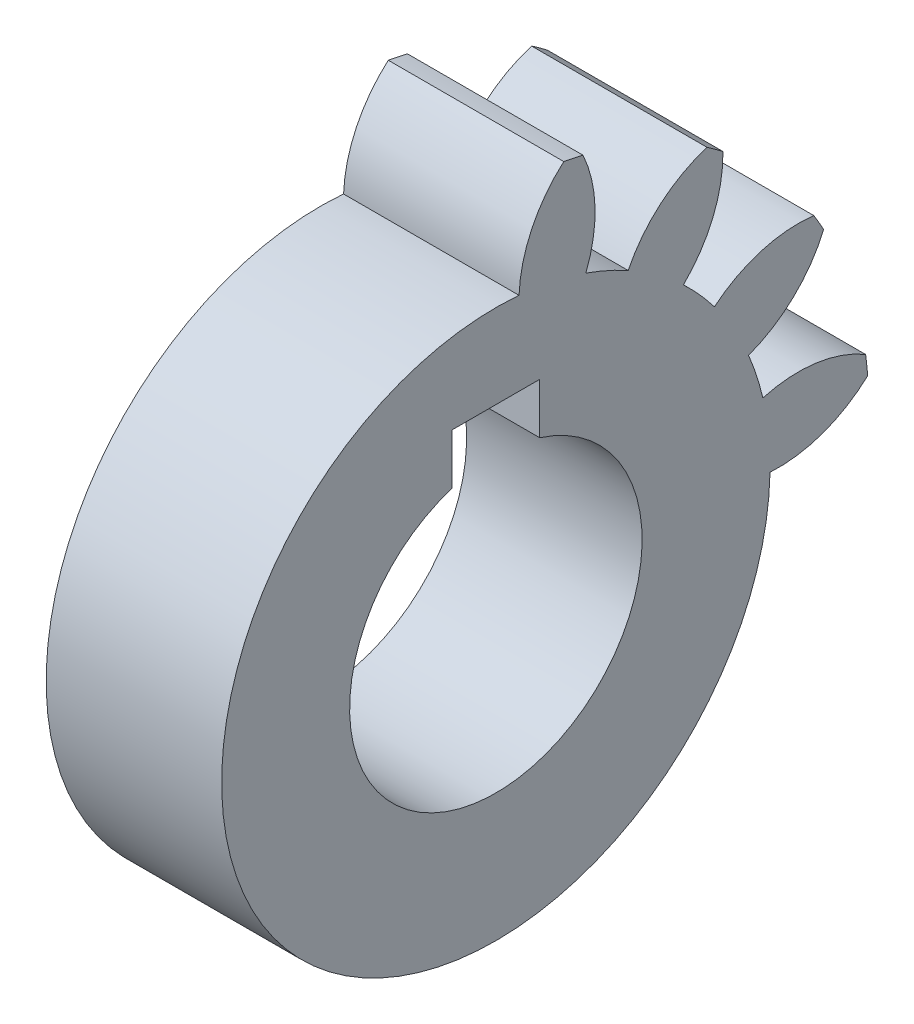
from build123d import *

# Parameters (mm, degrees)
BASPROSKE_W             = 12
BASPROSKE_H             = 25.5
TOOTHCUT_DEPTH          = 39.006578378
TEETHCUTS_COUNT         = 15
TEETHCUTS_ANGLE         = 336
BORSKE_R                = 10
BORE_DEPTH              = 50.0000508
CUT_EXTRUDE1_DEPTH      = 38.954121274
CUT_EXTRUDE2_DEPTH      = 38.669115521
CUT_EXTRUDE2_DEPTH_BACK = 38.669115521
SKETCH3_W               = 6
SKETCH3_H               = 6


with BuildPart() as part:
    # BasProSke → Base-Revolve (revolve)
    with BuildSketch(Plane(origin=(0, 0, 0), x_dir=(1, 0, 0), z_dir=(0, 1, 0)), mode=Mode.PRIVATE) as base_revolve_sk:
        with Locations((6, 12.75)):
            Rectangle(BASPROSKE_W, BASPROSKE_H)
    revolve(base_revolve_sk.sketch.rotate(Axis((-10, 0, 0), (1, 0, 0)), 180), axis=Axis((-10, 0, 0), (1, 0, 0)))

    # TooCutSke → ToothCut (cut, through all)
    with BuildSketch(Plane(origin=(0, 0, 0), x_dir=(0, 0, -1), z_dir=(1, 0, 0))):
        with BuildLine():
            ThreePointArc((1.584594428, 18.681918036), (0, 18.749), (-1.584594428, 18.681918036))
            ThreePointArc((-1.584594428, 18.681918036), (-2.465052499, 22.206073835), (-4.666912141, 25.095138498))
            ThreePointArc((-4.666912141, 25.095138498), (0, 25.5254), (4.666912141, 25.095138498))
            ThreePointArc((4.666912141, 25.095138498), (2.465052499, 22.206073835), (1.584594428, 18.681918036))
        make_face()
    toothcut = extrude(amount=TOOTHCUT_DEPTH, mode=Mode.SUBTRACT)

    # TeethCuts: ToothCut ×15 about axis
    teethcuts_axis = Axis((-10, 0, 0), (1, 0, 0))
    for i in range(1, TEETHCUTS_COUNT):
        add(toothcut.rotate(teethcuts_axis, i * TEETHCUTS_ANGLE / (TEETHCUTS_COUNT - 1)), mode=Mode.SUBTRACT)

    # BorSke → Bore (cut, symmetric)
    with BuildSketch(Plane(origin=(0, 0, 0), x_dir=(0, 0, -1), z_dir=(1, 0, 0))):
        with Locations(Location((0, 0, 0), (0, 0, 180))):
            Circle(BORSKE_R)
    extrude(amount=BORE_DEPTH, both=True, mode=Mode.SUBTRACT)

    # Sketch1 → Cut-Extrude1 (cut, through all)
    with BuildSketch(Plane(origin=(0, 0, 0), x_dir=(0, 0, -1), z_dir=(1, 0, 0))):
        with BuildLine():
            ThreePointArc((18.677788491, -1.632549567), (-13.822692806, -12.667208239), (0, 18.749))
            Line((0, 18.749), (0, 29.219389367))
            Line((0, 29.219389367), (-29.845264735, 29.219389367))
            Line((-29.845264735, 29.219389367), (-29.845264735, -32.484488502))
            Line((-29.845264735, -32.484488502), (30.166423099, -32.484488502))
            Line((30.166423099, -32.484488502), (30.166423099, -1.632549567))
            Line((30.166423099, -1.632549567), (18.677788491, -1.632549567))
        make_face()
    extrude(amount=CUT_EXTRUDE1_DEPTH, mode=Mode.SUBTRACT)

    # Sketch3 → Cut-Extrude2 (cut, two sides: drawn at the far end of the back side and taken through both)
    with BuildSketch(Plane(origin=(0, 0, 0), x_dir=(0, 0, -1), z_dir=(1, 0, 0)).offset(-CUT_EXTRUDE2_DEPTH_BACK)):
        with Locations((0, 10)):
            Rectangle(SKETCH3_W, SKETCH3_H)
    extrude(amount=CUT_EXTRUDE2_DEPTH + CUT_EXTRUDE2_DEPTH_BACK, mode=Mode.SUBTRACT)


solid = part.part
